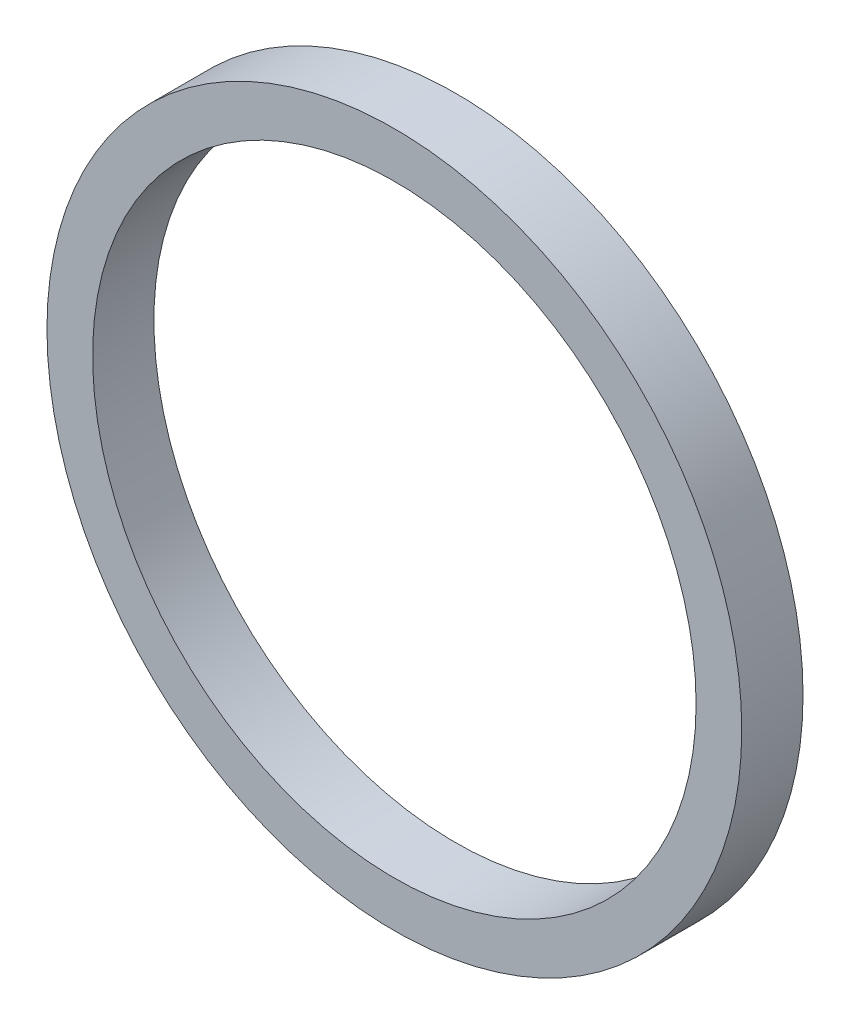
from build123d import *

# Parameters (mm, degrees)
SKETCH1_W = 0.558241758
SKETCH1_H = 0.749364756


with BuildPart() as part:
    # Sketch1 → Revolve1 (revolve)
    with BuildSketch(Plane(origin=(0, 0, 0), x_dir=(1, 0, 0), z_dir=(0, 1, 0))):
        with Locations((3.96875, -1.133442622)):
            Rectangle(SKETCH1_W, SKETCH1_H)
    revolve(axis=Axis((0, 0, 0.758760244), (0, 0, 1)))


solid = part.part
